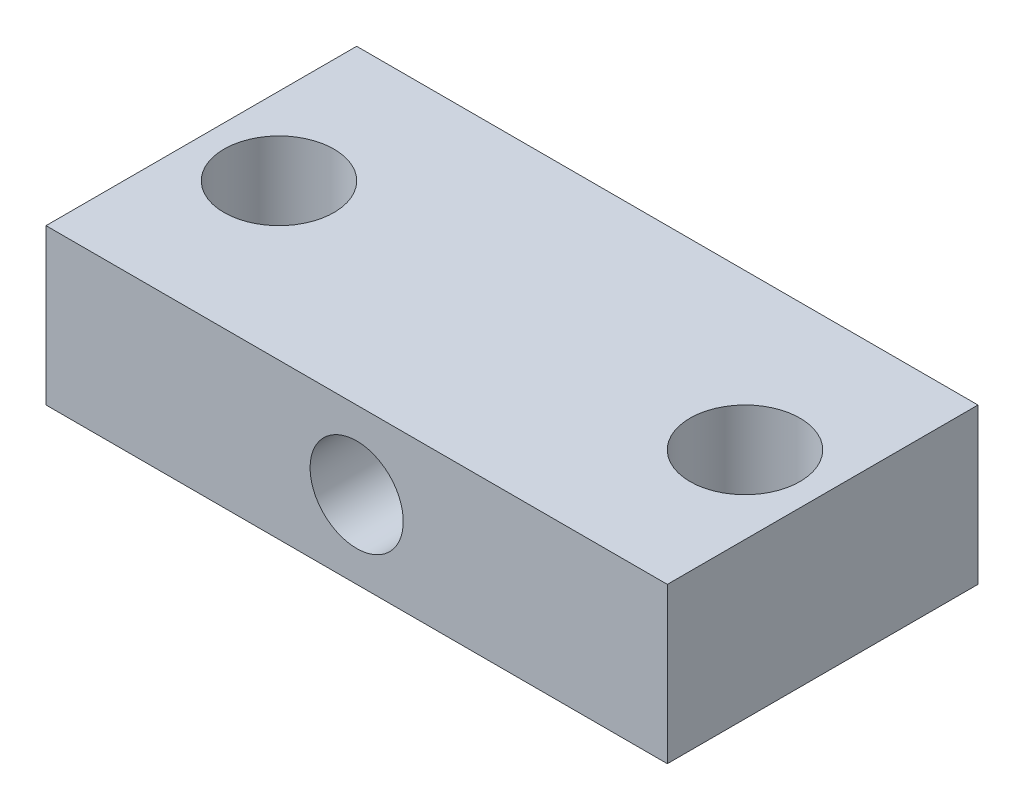
from build123d import *

# Parameters (mm, degrees)
SKETCH1_W             = 25.4
SKETCH1_H             = 12.7
BOSS_EXTRUDE1_DEPTH   = 6.35
SKETCH2_R             = 1.905
CUT_EXTRUDE1_DEPTH    = 20.05
F_8_CLEARANCE_HOLE1_D = 4.4958


with BuildPart() as part:
    # Sketch1 → Boss-Extrude1 (new body)
    with BuildSketch(Plane(origin=(0, 0, 0), x_dir=(1, 0, 0), z_dir=(0, 1, 0))):
        Rectangle(SKETCH1_W, SKETCH1_H)
    extrude(amount=BOSS_EXTRUDE1_DEPTH)

    # Sketch2 → Cut-Extrude1 (cut, through all)
    with BuildSketch(Plane(origin=(0, 0, -6.35), x_dir=(-1, 0, 0), z_dir=(0, 0, -1))):
        with Locations((0, 3.175)):
            Circle(SKETCH2_R)
    extrude(amount=-CUT_EXTRUDE1_DEPTH, mode=Mode.SUBTRACT)

    # #8 Clearance Hole1 (through all)
    with Locations(Plane(origin=(0, 6.35, 0), x_dir=(1, 0, 0), z_dir=(0, 1, 0))):
        with Locations((9.525, 0), (-9.525, 0)):
            Hole(F_8_CLEARANCE_HOLE1_D / 2)


solid = part.part
